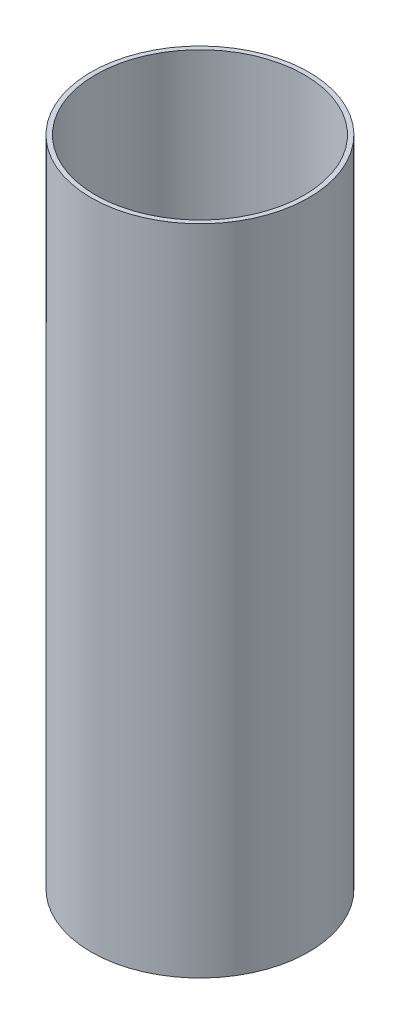
from build123d import *

# Parameters (mm, degrees)
SKETCH1_R           = 76.2
SKETCH1_R_2         = 73.025
BOSS_EXTRUDE1_DEPTH = 457.2


with BuildPart() as part:
    # Sketch1 → Boss-Extrude1 (new body)
    with BuildSketch(Plane(origin=(0, 0, 0), x_dir=(1, 0, 0), z_dir=(0, 1, 0))):
        with Locations(Location((0, 0, 0), (0, 0, 270))):
            Circle(SKETCH1_R)
        with Locations(Location((0, 0, 0), (0, 0, 270))):
            Circle(SKETCH1_R_2, mode=Mode.SUBTRACT)
    extrude(amount=BOSS_EXTRUDE1_DEPTH)


solid = part.part
